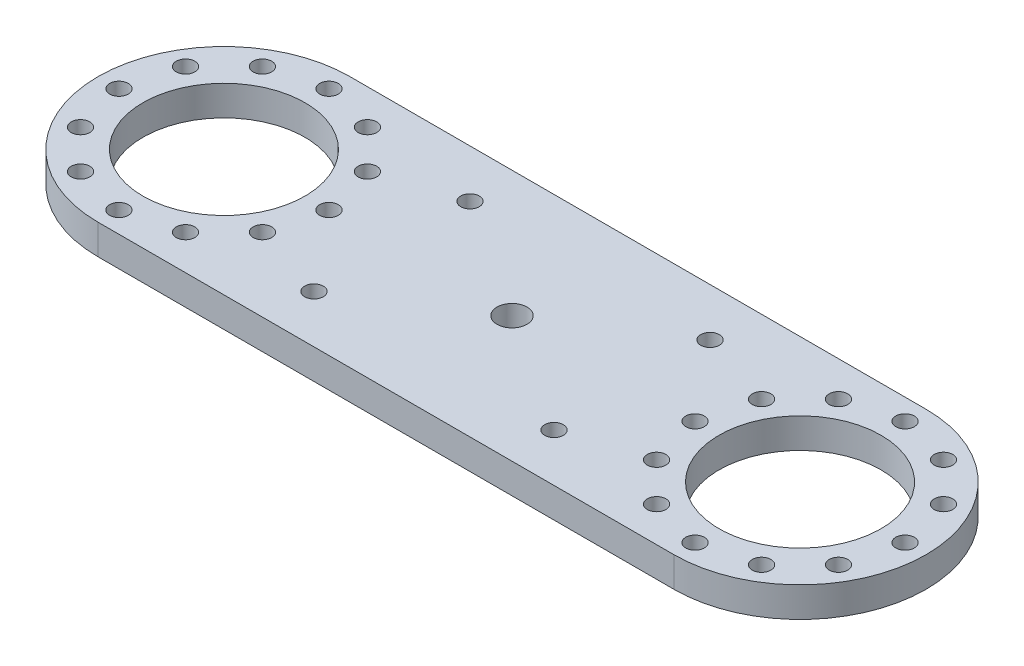
from build123d import *

# Parameters (mm, degrees)
SKETCH_1_R          = 13.5
SKETCH_1_R_2        = 1.55
EXTRUDE_1_DEPTH     = 5
SKETCH_2_R          = 2.5
CUT_EXTRUDE_1_DEPTH = 5


with BuildPart() as part:
    # 草图1 → 凸台-拉伸1 (new body)
    with BuildSketch(Plane(origin=(0, 0, 0), x_dir=(1, 0, 0), z_dir=(0, 1, 0))):
        with BuildLine():
            Line((-48, 21), (48, 21))
            ThreePointArc((48, 21), (69, 0), (48, -21))
            Line((48, -21), (-48, -21))
            ThreePointArc((-48, -21), (-69, 0), (-48, 21))
        make_face()
        with Locations(Location((-48, 0, 0), (0, 0, 270))):
            Circle(SKETCH_1_R, mode=Mode.SUBTRACT)
        with Locations(Location((-48, 17.5, 0), (0, 0, 270))):
            Circle(SKETCH_1_R_2, mode=Mode.SUBTRACT)
        with Locations(Location((-20, 13, 0), (0, 0, 270))):
            Circle(SKETCH_1_R_2, mode=Mode.SUBTRACT)
        with Locations(Location((-20, -13, 0), (0, 0, 270))):
            Circle(SKETCH_1_R_2, mode=Mode.SUBTRACT)
        with Locations(Location((-39.25, 15.155444566, 0), (0, 0, 270))):
            Circle(SKETCH_1_R_2, mode=Mode.SUBTRACT)
        with Locations(Location((-32.844555434, 8.75, 0), (0, 0, 270))):
            Circle(SKETCH_1_R_2, mode=Mode.SUBTRACT)
        with Locations(Location((-30.5, 0, 0), (0, 0, 270))):
            Circle(SKETCH_1_R_2, mode=Mode.SUBTRACT)
        with Locations(Location((-32.844555434, -8.75, 0), (0, 0, 270))):
            Circle(SKETCH_1_R_2, mode=Mode.SUBTRACT)
        with Locations(Location((-39.25, -15.155444566, 0), (0, 0, 270))):
            Circle(SKETCH_1_R_2, mode=Mode.SUBTRACT)
        with Locations(Location((-48, -17.5, 0), (0, 0, 270))):
            Circle(SKETCH_1_R_2, mode=Mode.SUBTRACT)
        with Locations(Location((-56.75, -15.155444566, 0), (0, 0, 270))):
            Circle(SKETCH_1_R_2, mode=Mode.SUBTRACT)
        with Locations(Location((-63.155444566, -8.75, 0), (0, 0, 270))):
            Circle(SKETCH_1_R_2, mode=Mode.SUBTRACT)
        with Locations(Location((-65.5, 0, 0), (0, 0, 270))):
            Circle(SKETCH_1_R_2, mode=Mode.SUBTRACT)
        with Locations(Location((-63.155444566, 8.75, 0), (0, 0, 270))):
            Circle(SKETCH_1_R_2, mode=Mode.SUBTRACT)
        with Locations(Location((-56.75, 15.155444566, 0), (0, 0, 270))):
            Circle(SKETCH_1_R_2, mode=Mode.SUBTRACT)
        with Locations(Location((56.75, 15.155444566, 0), (0, 0, 90))):
            Circle(SKETCH_1_R_2, mode=Mode.SUBTRACT)
        with Locations(Location((63.155444566, 8.75, 0), (0, 0, 90))):
            Circle(SKETCH_1_R_2, mode=Mode.SUBTRACT)
        with Locations(Location((65.5, 0, 0), (0, 0, 90))):
            Circle(SKETCH_1_R_2, mode=Mode.SUBTRACT)
        with Locations(Location((63.155444566, -8.75, 0), (0, 0, 90))):
            Circle(SKETCH_1_R_2, mode=Mode.SUBTRACT)
        with Locations(Location((56.75, -15.155444566, 0), (0, 0, 90))):
            Circle(SKETCH_1_R_2, mode=Mode.SUBTRACT)
        with Locations(Location((48, -17.5, 0), (0, 0, 90))):
            Circle(SKETCH_1_R_2, mode=Mode.SUBTRACT)
        with Locations(Location((39.25, -15.155444566, 0), (0, 0, 90))):
            Circle(SKETCH_1_R_2, mode=Mode.SUBTRACT)
        with Locations(Location((32.844555434, -8.75, 0), (0, 0, 90))):
            Circle(SKETCH_1_R_2, mode=Mode.SUBTRACT)
        with Locations(Location((30.5, 0, 0), (0, 0, 90))):
            Circle(SKETCH_1_R_2, mode=Mode.SUBTRACT)
        with Locations(Location((39.25, 15.155444566, 0), (0, 0, 90))):
            Circle(SKETCH_1_R_2, mode=Mode.SUBTRACT)
        with Locations(Location((20, -13, 0), (0, 0, 90))):
            Circle(SKETCH_1_R_2, mode=Mode.SUBTRACT)
        with Locations(Location((20, 13, 0), (0, 0, 90))):
            Circle(SKETCH_1_R_2, mode=Mode.SUBTRACT)
        with Locations(Location((48, 17.5, 0), (0, 0, 90))):
            Circle(SKETCH_1_R_2, mode=Mode.SUBTRACT)
        with Locations(Location((48, 0, 0), (0, 0, 90))):
            Circle(SKETCH_1_R, mode=Mode.SUBTRACT)
        with Locations(Location((32.844555434, 8.75, 0), (0, 0, 90))):
            Circle(SKETCH_1_R_2, mode=Mode.SUBTRACT)
    extrude(amount=EXTRUDE_1_DEPTH)

    # 草图2 → 切除-拉伸1 (cut)
    with BuildSketch(Plane(origin=(0, 5, 0), x_dir=(1, 0, 0), z_dir=(0, 1, 0))):
        with Locations(Location((0, 0, 0), (0, 0, 270))):
            Circle(SKETCH_2_R)
    extrude(amount=-CUT_EXTRUDE_1_DEPTH, mode=Mode.SUBTRACT)


solid = part.part
